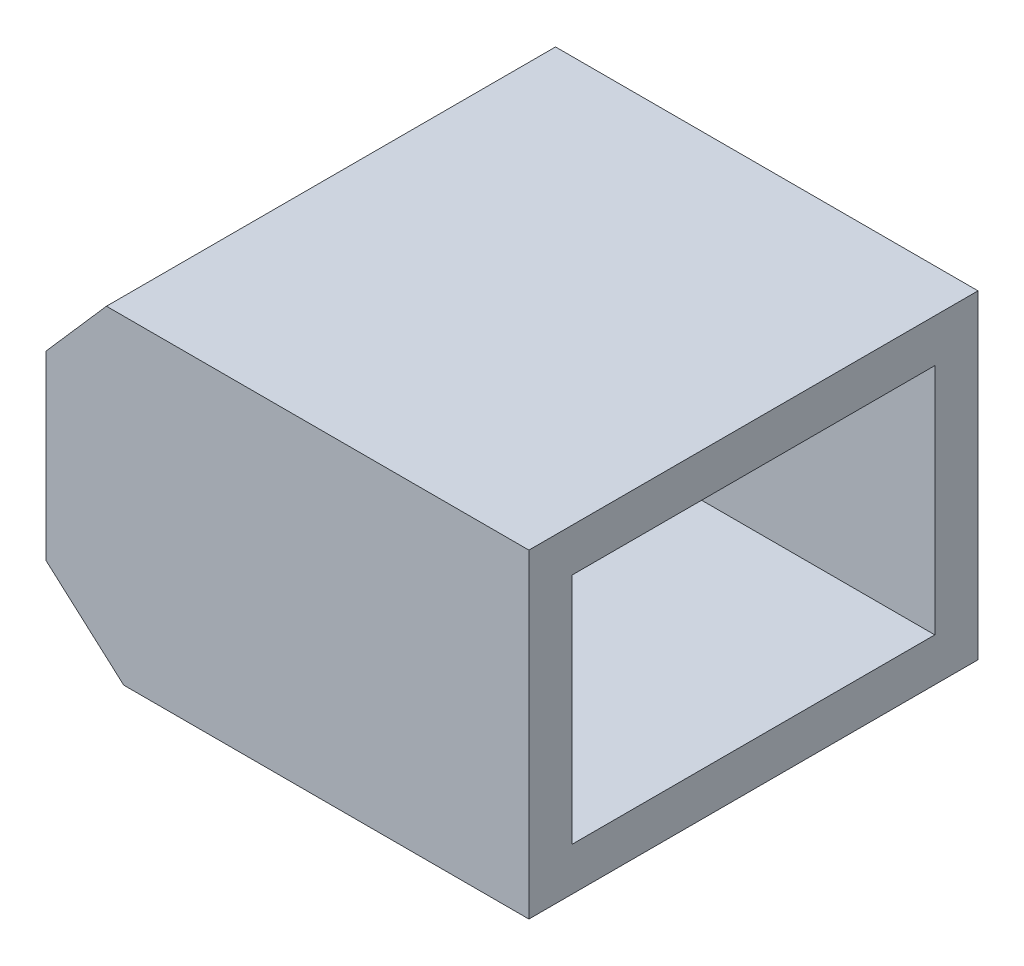
from build123d import *

# Parameters (mm, degrees)
CLOSING_LIP_PROFILE_DEPTH = 52
SHELL_1_T                 = -5


with BuildPart() as part:
    # 草图1 → Closing_lip_profile (new body)
    with BuildSketch(Plane.XY):
        Polygon((0.915165953, 0), (-48, 0), (-55, -8), (-55, -29), (-46, -37), (0.915165953, -37), align=None)
    extrude(amount=CLOSING_LIP_PROFILE_DEPTH)

    # 抽壳1
    shell_1_openings = [part.faces().sort_by_distance(p)[0] for p in [
        (0.915165953, -18.5, 26),
    ]]
    offset(amount=SHELL_1_T, openings=shell_1_openings, kind=Kind.INTERSECTION)


solid = part.part
